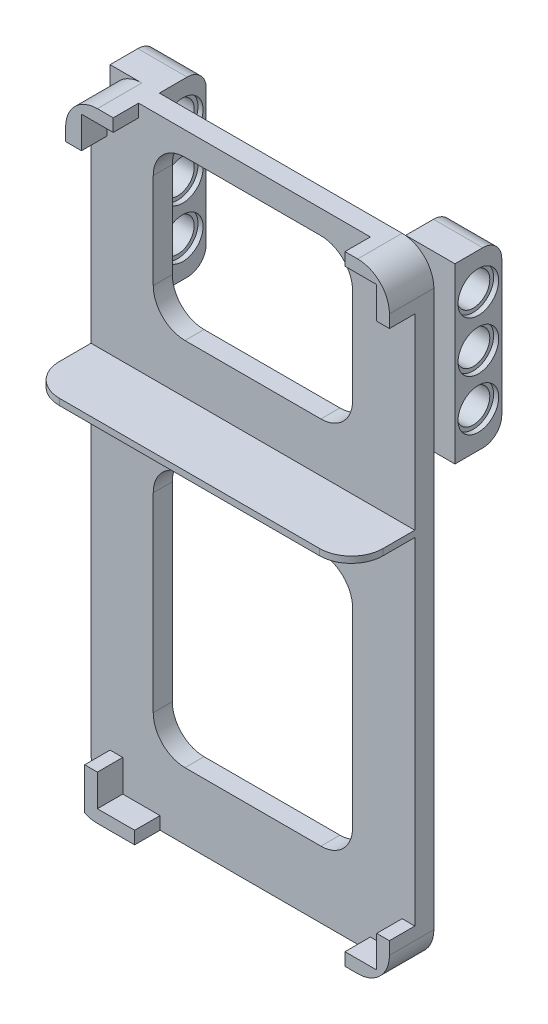
from build123d import *

# Parameters (mm, degrees)
SKETCH1_W           = 51
SKETCH1_H           = 97.5
BOSS_EXTRUDE2_DEPTH = 3
BOSS_EXTRUDE3_DEPTH = 4
BOSS_EXTRUDE4_DEPTH = 4
SKETCH5_W           = 51
SKETCH5_H           = 1
BOSS_EXTRUDE5_DEPTH = 10
CUT_EXTRUDE1_DEPTH  = 10
FILLET1_R           = 5
SKETCH8_R           = 2.6
BOSS_EXTRUDE6_DEPTH = 7.76
SKETCH9_R           = 3.2
CUT_EXTRUDE2_DEPTH  = 0.8
CUT_EXTRUDE3_START  = -0.8
SKETCH10_R          = 3.2
CUT_EXTRUDE3_DEPTH  = 0.8
FILLET2_R           = 3


with BuildPart() as part:
    # Sketch1 → Boss-Extrude2 (new body)
    with BuildSketch(Plane.XY):
        with Locations((25.5, 48.75)):
            Rectangle(SKETCH1_W, SKETCH1_H)
    extrude(amount=BOSS_EXTRUDE2_DEPTH)

    # Sketch3 → Boss-Extrude3 (add)
    with BuildSketch(Plane.XY.offset(3)):
        Polygon((0, 97.5), (7.5, 97.5), (7.5, 95.5), (2.5, 95.5), (2.5, 90.5), (0, 90.5), align=None)
        Polygon((51, 97.5), (44, 97.5), (44, 95.5), (49, 95.5), (49, 90.5), (51, 90.5), align=None)
        Polygon((51, 0), (44, 0), (44, 2), (49, 2), (49, 7), (51, 7), align=None)
    extrude(amount=BOSS_EXTRUDE3_DEPTH)

    # Sketch4 → Boss-Extrude4 (add)
    with BuildSketch(Plane.XY.offset(3)):
        Polygon((3, 0), (3, 7), (5, 7), (5, 2), (10.869482621, 2), (10.869482621, 0), align=None)
    extrude(amount=BOSS_EXTRUDE4_DEPTH)

    # Sketch5 → Boss-Extrude5 (add)
    with BuildSketch(Plane.XY.offset(3)):
        with Locations((25.5, 60.5)):
            Rectangle(SKETCH5_W, SKETCH5_H)
    extrude(amount=BOSS_EXTRUDE5_DEPTH)

    # Sketch6 → Cut-Extrude1 (cut)
    with BuildSketch(Plane.XY.offset(3)):
        Polygon((39.8, 93.770532131), (9.8, 93.770532131), (9.8, 68.770532131), (41.2, 68.770532131), (41.2, 93.770532131), align=None)
        Polygon((39.8, 50.5), (9.8, 50.5), (9.8, 10.5), (41.2, 10.5), (41.2, 50.5), align=None)
    extrude(amount=-CUT_EXTRUDE1_DEPTH, mode=Mode.SUBTRACT)

    # Fillet1
    fillet1_edges = [part.edges().sort_by_distance(p)[0] for p in [
        (0, 60.5, 13),
        (51, 60.5, 13),
        (9.8, 50.5, 1.5),
        (9.8, 93.770532131, 1.5),
        (41.2, 93.770532131, 1.5),
        (41.2, 10.5, 1.5),
        (9.8, 10.5, 1.5),
        (41.2, 50.5, 1.5),
        (51, 0, 3.5),
        (51, 97.5, 3.5),
        (0, 97.5, 3.5),
        (9.8, 68.770532131, 1.5),
        (41.2, 68.770532131, 1.5),
        (0, 0, 1.5),
    ]]
    fillet(fillet1_edges, radius=FILLET1_R)

    # Sketch8 → Boss-Extrude6 (add)
    with BuildSketch(Plane.ZY):
        Polygon((0, 81.56), (0, 89.53), (0, 92.5), (0, 97.5), (-7.38, 97.5), (-7.38, 70.18), (0, 70.18), align=None)
        with Locations((-3.69, 75.87)):
            Circle(SKETCH8_R, mode=Mode.SUBTRACT)
        with Locations((-3.69, 91.81)):
            Circle(SKETCH8_R, mode=Mode.SUBTRACT)
        with Locations((-3.69, 83.84)):
            Circle(SKETCH8_R, mode=Mode.SUBTRACT)
    boss_extrude6 = extrude(amount=-BOSS_EXTRUDE6_DEPTH)

    # Sketch9 → Cut-Extrude2 (cut)
    with BuildSketch(Plane.ZY):
        with Locations((-3.69, 91.81)):
            Circle(SKETCH9_R)
        with Locations((-3.69, 83.84)):
            Circle(SKETCH9_R)
        with Locations((-3.69, 75.87)):
            Circle(SKETCH9_R)
    cut_extrude2 = extrude(amount=-CUT_EXTRUDE2_DEPTH, mode=Mode.SUBTRACT)

    # Sketch10 → Cut-Extrude3 (cut)
    with BuildSketch(Plane(origin=(7.76, 0, 0), x_dir=(0, 0, -1), z_dir=(1, 0, 0)).offset(CUT_EXTRUDE3_START)):
        with Locations(Location((3.69, 91.81, 0), (0, 0, 180))):
            Circle(SKETCH10_R)
        with Locations(Location((3.69, 83.84, 0), (0, 0, 180))):
            Circle(SKETCH10_R)
        with Locations(Location((3.69, 75.87, 0), (0, 0, 180))):
            Circle(SKETCH10_R)
    cut_extrude3 = extrude(amount=CUT_EXTRUDE3_DEPTH, mode=Mode.SUBTRACT)

    # Mirror2: Boss-Extrude6, Cut-Extrude2, Cut-Extrude3 across plane
    add(boss_extrude6.mirror(Plane(origin=(27.16, 0, 0), x_dir=(0, 0, 1), z_dir=(1, 0, 0))))
    add(cut_extrude2.mirror(Plane(origin=(27.16, 0, 0), x_dir=(0, 0, 1), z_dir=(1, 0, 0))), mode=Mode.SUBTRACT)
    add(cut_extrude3.mirror(Plane(origin=(27.16, 0, 0), x_dir=(0, 0, 1), z_dir=(1, 0, 0))), mode=Mode.SUBTRACT)

    # Fillet2
    fillet2_edges = [part.edges().sort_by_distance(p)[0] for p in [
        (3.88, 97.5, -7.38),
        (3.88, 70.18, -7.38),
        (50.44, 97.5, -7.38),
        (50.44, 70.18, -7.38),
    ]]
    fillet(fillet2_edges, radius=FILLET2_R)


solid = part.part
